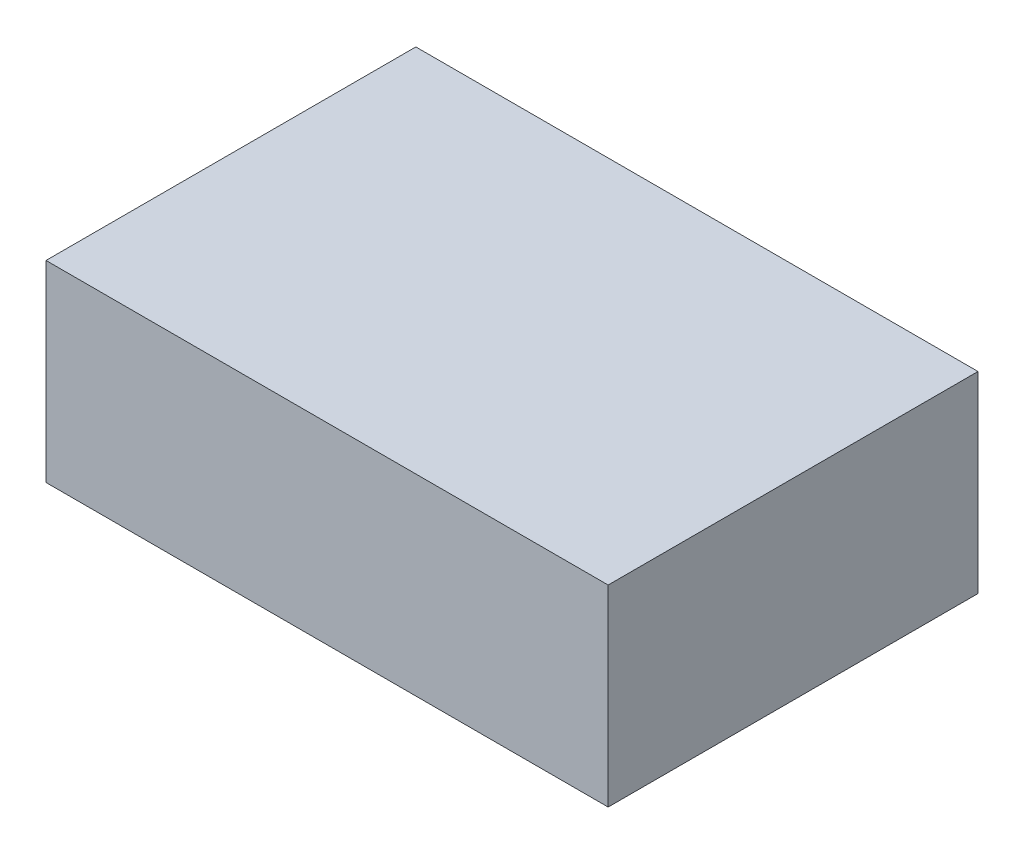
from build123d import *

# Parameters (mm, degrees)
SKETCH_1_W      = 152
SKETCH_1_H      = 100
EXTRUDE_1_DEPTH = 52


with BuildPart() as part:
    # 草图1 → 凸台-拉伸1 (new body)
    with BuildSketch(Plane(origin=(0, 0, 0), x_dir=(1, 0, 0), z_dir=(0, 1, 0))):
        Rectangle(SKETCH_1_W, SKETCH_1_H)
    extrude(amount=EXTRUDE_1_DEPTH)


solid = part.part
